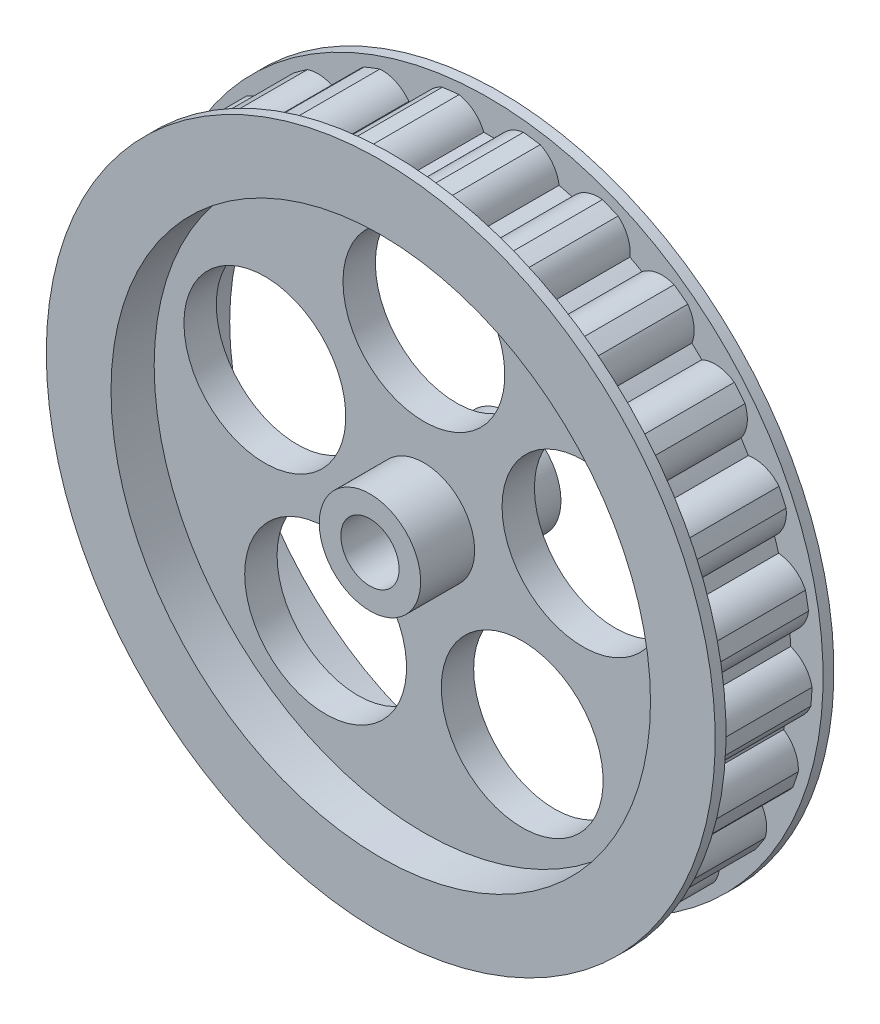
from build123d import *

# Parameters (mm, degrees)
CUT_EXTRUDE1_DEPTH  = 44.370496884
CIRPATTERN1_COUNT   = 25
SKETCH3_R           = 7.5
CUT_EXTRUDE2_DEPTH  = 43.84000856
CIRPATTERN2_COUNT   = 5
BOSS_EXTRUDE1_START = 1
SKETCH4_R           = 31
SKETCH4_R_2         = 25
BOSS_EXTRUDE1_DEPTH = 1
BOSS_EXTRUDE2_START = 5
SKETCH5_R           = 4.7
SKETCH5_R_2         = 2.7
BOSS_EXTRUDE2_DEPTH = 5


with BuildPart() as part:
    # Sketch1 → Revolve1 (revolve)
    with BuildSketch(Plane(origin=(0, 0, 0), x_dir=(0, 0, -1), z_dir=(1, 0, 0)), mode=Mode.PRIVATE) as revolve1_sk:
        Polygon((-4.5, 25), (-1.5, 25), (-1.5, 2.7), (1.5, 2.7), (1.5, 25), (4.5, 25), (4.5, 30), (-4.5, 30), align=None)
    revolve(revolve1_sk.sketch.rotate(Axis((0, 0, 3.054222254), (0, 0, -1)), 90), axis=Axis((0, 0, 3.054222254), (0, 0, -1)))

    # Sketch2 → Cut-Extrude1 (cut, through all)
    with BuildSketch(Plane(origin=(0, 0, -4.5), x_dir=(-1, 0, 0), z_dir=(0, 0, -1))):
        with BuildLine():
            ThreePointArc((0.450015258, 27.99638345), (-0.18373464, 27.999397165), (-0.817390411, 27.988066616))
            ThreePointArc((-0.817390411, 27.988066616), (-1.770903861, 29.232790202), (-3.222137334, 29.826461926))
            ThreePointArc((-3.222137334, 29.826461926), (-0.243371977, 29.999012818), (2.73780082, 29.874812914))
            ThreePointArc((2.73780082, 29.874812914), (1.353306055, 29.228633271), (0.450015258, 27.99638345))
        make_face()
    cut_extrude1 = extrude(amount=-CUT_EXTRUDE1_DEPTH, mode=Mode.SUBTRACT)

    # CirPattern1: Cut-Extrude1 ×25 about axis
    cirpattern1_axis = Axis((0, 0, 0), (0, 0, 1))
    for i in range(1, CIRPATTERN1_COUNT):
        add(cut_extrude1.rotate(cirpattern1_axis, i * 360 / CIRPATTERN1_COUNT), mode=Mode.SUBTRACT)

    # Sketch3 → Cut-Extrude2 (cut, through all)
    with BuildSketch(Plane(origin=(0, 0, -1.5), x_dir=(-1, 0, 0), z_dir=(0, 0, -1))):
        with Locations((0, 15.5)):
            Circle(SKETCH3_R)
    cut_extrude2 = extrude(amount=-CUT_EXTRUDE2_DEPTH, mode=Mode.SUBTRACT)

    # CirPattern2: Cut-Extrude2 ×5 about axis
    cirpattern2_axis = Axis((0, 0, 0), (0, 0, 1))
    for i in range(1, CIRPATTERN2_COUNT):
        add(cut_extrude2.rotate(cirpattern2_axis, i * 360 / CIRPATTERN2_COUNT), mode=Mode.SUBTRACT)

    # Sketch4 → Boss-Extrude1 (add)
    with BuildSketch(Plane(origin=(0, 0, -4.5), x_dir=(-1, 0, 0), z_dir=(0, 0, -1)).offset(BOSS_EXTRUDE1_START)):
        Circle(SKETCH4_R)
        with Locations(Location((0, 0, 0), (0, 0, 180))):
            Circle(SKETCH4_R_2, mode=Mode.SUBTRACT)
    boss_extrude1 = extrude(amount=-BOSS_EXTRUDE1_DEPTH)

    # Sketch5 → Boss-Extrude2 (add)
    with BuildSketch(Plane(origin=(0, 0, -1.5), x_dir=(-1, 0, 0), z_dir=(0, 0, -1)).offset(BOSS_EXTRUDE2_START)):
        with Locations(Location((0, 0, 0), (0, 0, 180))):
            Circle(SKETCH5_R)
        with Locations(Location((0, 0, 0), (0, 0, 180))):
            Circle(SKETCH5_R_2, mode=Mode.SUBTRACT)
    boss_extrude2 = extrude(amount=-BOSS_EXTRUDE2_DEPTH)

    # Mirror2: Boss-Extrude2 across plane
    add(boss_extrude2.mirror(Plane.XY))

    # Mirror3: Boss-Extrude1 across plane
    add(boss_extrude1.mirror(Plane.XY))


solid = part.part
